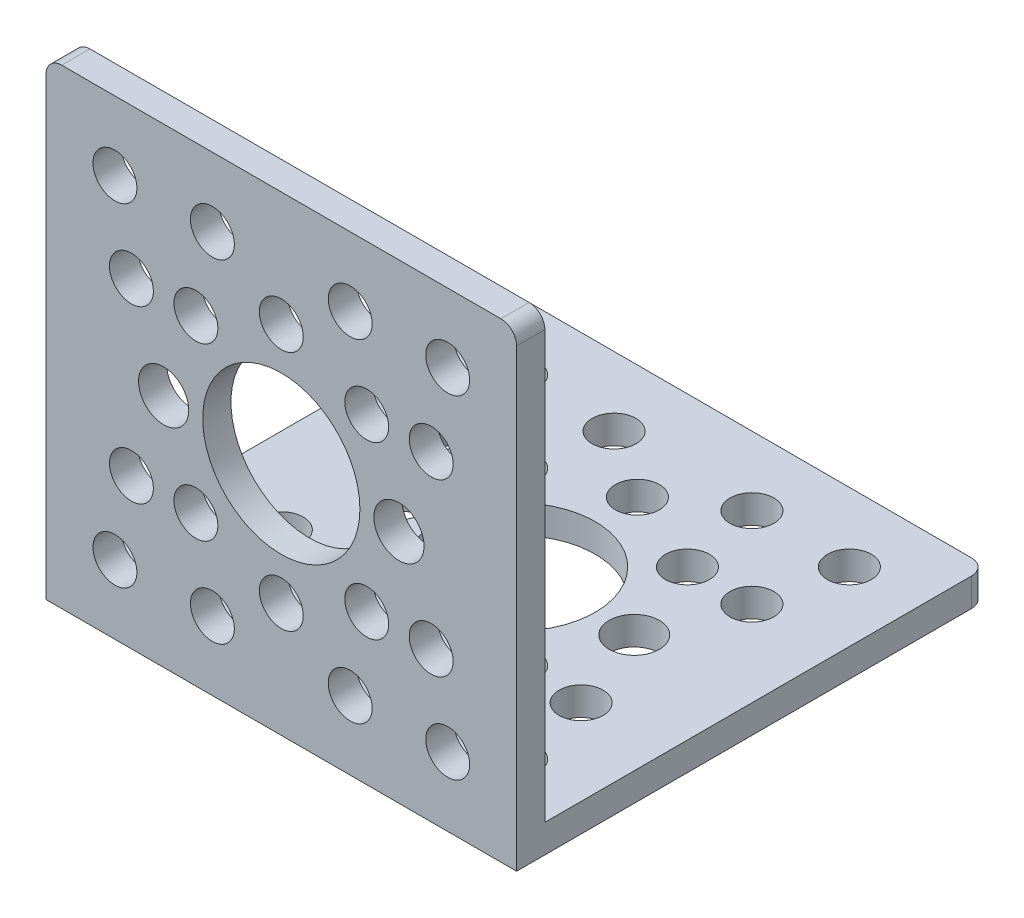
from build123d import *

# Parameters (mm, degrees)
SKETCH1_W                  = 38.1
SKETCH1_H                  = 38.1
BOSS_EXTRUDE1_DEPTH        = 38.1
SKETCH2_W                  = 35.814
SKETCH2_H                  = 35.814
CUT_EXTRUDE1_DEPTH         = 58.15
HOLE1_D                    = 12.7254
HOLE1_DEPTH                = 38.1
M3_5_CLEARANCE_HOLE1_D     = 4.064
M3_5_CLEARANCE_HOLE1_DEPTH = 38.1
M3_CLEARANCE_HOLE1_D       = 3.556
M3_CLEARANCE_HOLE1_DEPTH   = 38.1
HOLE2_D                    = 12.7254
M3_5_CLEARANCE_HOLE2_D     = 4.064
M3_CLEARANCE_HOLE2_D       = 3.556
FILLET1_R                  = 1.27


with BuildPart() as part:
    # Sketch1 → Boss-Extrude1 (new body)
    with BuildSketch(Plane.XZ):
        Rectangle(SKETCH1_W, SKETCH1_H)
    extrude(amount=-BOSS_EXTRUDE1_DEPTH)

    # Sketch2 → Cut-Extrude1 (cut, through all)
    with BuildSketch(Plane.ZY.offset(19.05)):
        with Locations((-1.143, 20.193)):
            Rectangle(SKETCH2_W, SKETCH2_H)
    extrude(amount=-CUT_EXTRUDE1_DEPTH, mode=Mode.SUBTRACT)

    # Hole1
    with Locations(Plane.XY.offset(19.05)):
        with Locations((0, 19.05)):
            Hole(HOLE1_D / 2, depth=HOLE1_DEPTH)

    # M3.5 Clearance Hole1
    with Locations(Plane.XY.offset(19.05)):
        with Locations((-9.525, 19.05), (9.525, 19.05)):
            Hole(M3_5_CLEARANCE_HOLE1_D / 2, depth=M3_5_CLEARANCE_HOLE1_DEPTH)

    # M3 Clearance Hole1
    with Locations(Plane.XY.offset(19.05)):
        with Locations((12.135202787, 12.135202787), (-5.579615818, 32.520384182), (-12.135202787, 25.964797213), (5.579615818, 32.520384182), (12.135202787, 25.964797213), (13.470384182, 32.520384182), (-13.470384182, 5.579615818), (-13.470384182, 32.520384182), (13.470384182, 5.579615818), (6.914797213, 25.964797213), (6.914797213, 12.135202787), (0, 9.271), (-6.914797213, 12.135202787), (-6.914797213, 25.964797213), (0, 28.829), (-12.135202787, 12.135202787), (-5.579615818, 5.579615818), (5.579615818, 5.579615818)):
            Hole(M3_CLEARANCE_HOLE1_D / 2, depth=M3_CLEARANCE_HOLE1_DEPTH)

    # Hole2 (through all)
    with Locations(Plane(origin=(0, 2.286, 0), x_dir=(1, 0, 0), z_dir=(0, 1, 0))):
        with Locations((0, 0)):
            Hole(HOLE2_D / 2)

    # M3.5 Clearance Hole2 (through all)
    with Locations(Plane(origin=(0, 2.286, 0), x_dir=(1, 0, 0), z_dir=(0, 1, 0))):
        with Locations((-9.525, 0), (9.525, 0)):
            Hole(M3_5_CLEARANCE_HOLE2_D / 2)

    # M3 Clearance Hole2 (through all)
    with Locations(Plane(origin=(0, 2.286, 0), x_dir=(1, 0, 0), z_dir=(0, 1, 0))):
        with Locations((5.579615818, -13.470384182), (12.135202787, -6.914797213), (-5.579615818, -13.470384182), (-12.135202787, -6.914797213), (-5.579615818, 13.470384182), (-12.135202787, 6.914797213), (5.579615818, 13.470384182), (12.135202787, 6.914797213), (-13.470384182, 13.470384182), (13.470384182, -13.470384182), (13.470384182, 13.470384182), (-13.470384182, -13.470384182), (-6.914797213, 6.914797213), (-6.914797213, -6.914797213), (0, -9.779), (6.914797213, -6.914797213), (6.914797213, 6.914797213), (0, 9.779)):
            Hole(M3_CLEARANCE_HOLE2_D / 2)

    # Fillet1
    fillet1_edges = [part.edges().sort_by_distance(p)[0] for p in [
        (19.05, 38.1, 17.907),
        (-19.05, 1.143, -19.05),
        (19.05, 1.143, -19.05),
        (-19.05, 38.1, 17.907),
    ]]
    fillet(fillet1_edges, radius=FILLET1_R)


solid = part.part
